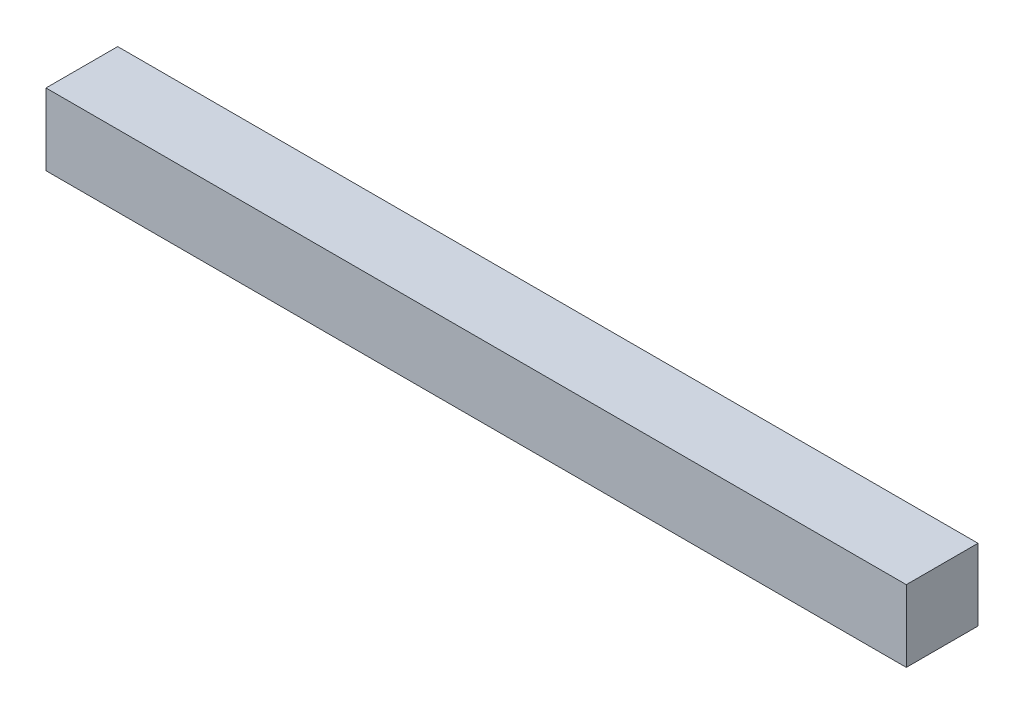
from build123d import *

# Parameters (mm, degrees)
SKETCH1_W           = 25.4
SKETCH1_H           = 25.4
BOSS_EXTRUDE1_DEPTH = 304.8


with BuildPart() as part:
    # Sketch1 → Boss-Extrude1 (new body)
    with BuildSketch(Plane(origin=(0, 0, 0), x_dir=(0, 0, -1), z_dir=(1, 0, 0))):
        with Locations((-12.7, -12.7)):
            Rectangle(SKETCH1_W, SKETCH1_H)
    extrude(amount=BOSS_EXTRUDE1_DEPTH)


solid = part.part
